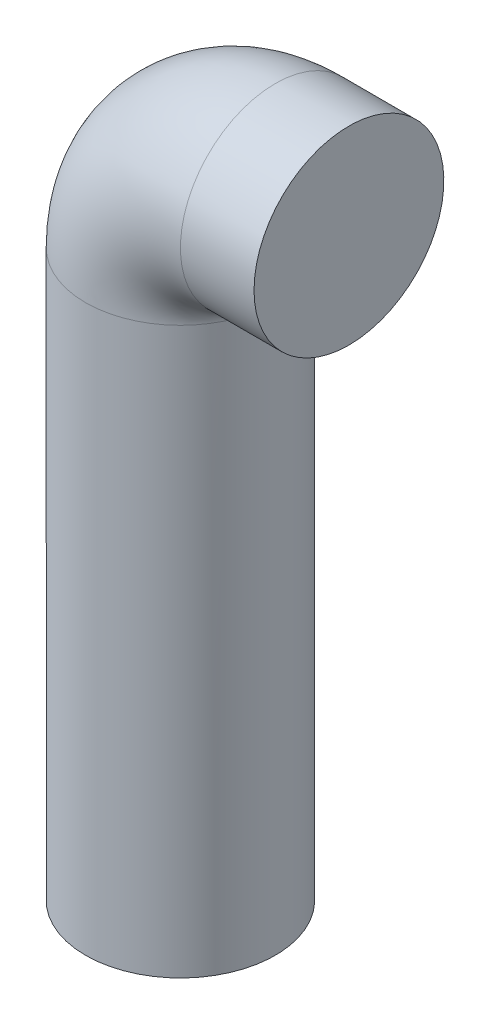
from build123d import *

# Parameters (mm, degrees)
SKETCH5_R = 25


with BuildPart() as part:
    # Sweep2: sweep along a path in Sketch4
    with BuildLine(Plane.XY) as sweep2_path:
        Line((0, 0), (0, 148.9))
        ThreePointArc((0, 148.9), (7.32233047, 166.57766953), (25, 173.9))
        Line((25, 173.9), (44.39, 173.9))
    # Sketch5 → Sweep2 (sweep)
    with BuildSketch(Plane(origin=(0, 0, 0), x_dir=(1, 0, 0), z_dir=(0, 1, 0))):
        Circle(SKETCH5_R)
    sweep(path=sweep2_path.line)


solid = part.part
